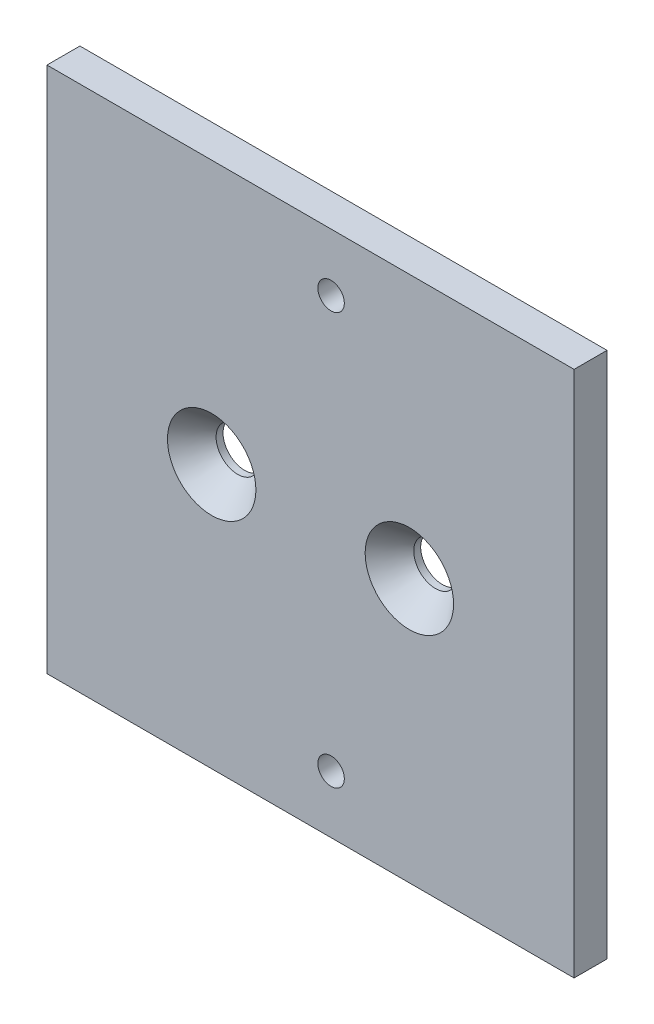
from build123d import *

# Parameters (mm, degrees)
SKETCH1_W               = 101.6
SKETCH1_H               = 101.6
SKETCH1_R               = 4.1656
BOSS_EXTRUDE1_DEPTH     = 3.175
F_1_4_20_TAPPED_HOLE1_D = 5.1054


with BuildPart() as part:
    # Sketch1 → Boss-Extrude1 (new, symmetric)
    with BuildSketch(Plane.XY):
        Rectangle(SKETCH1_W, SKETCH1_H)
        with Locations((-19.05, 0)):
            Circle(SKETCH1_R, mode=Mode.SUBTRACT)
        with Locations((19.05, 0)):
            Circle(SKETCH1_R, mode=Mode.SUBTRACT)
    extrude(amount=BOSS_EXTRUDE1_DEPTH, both=True)

    # Sketch2 → Cut-Revolve1 (revolve, cut)
    with BuildSketch(Plane(origin=(0, 0, 0), x_dir=(1, 0, 0), z_dir=(0, 1, 0))):
        Polygon((-10.5283, -3.175), (-19.05, 6.628094456), (-19.05, -3.175), align=None)
    cut_revolve1 = revolve(axis=Axis((-19.05, 0, -6.628094456), (0, 0, 1)), mode=Mode.SUBTRACT)

    # Sketch-Pattern1: Cut-Revolve1 at 1 more place
    with Locations((38.1, 0, 0)):
        add(cut_revolve1, mode=Mode.SUBTRACT)

    # 1/4-20 Tapped Hole1 (through all)
    with Locations(Plane.XY.offset(3.175)):
        with Locations((3.9624, -39.6875), (3.9624, 39.6875)):
            Hole(F_1_4_20_TAPPED_HOLE1_D / 2)


solid = part.part
